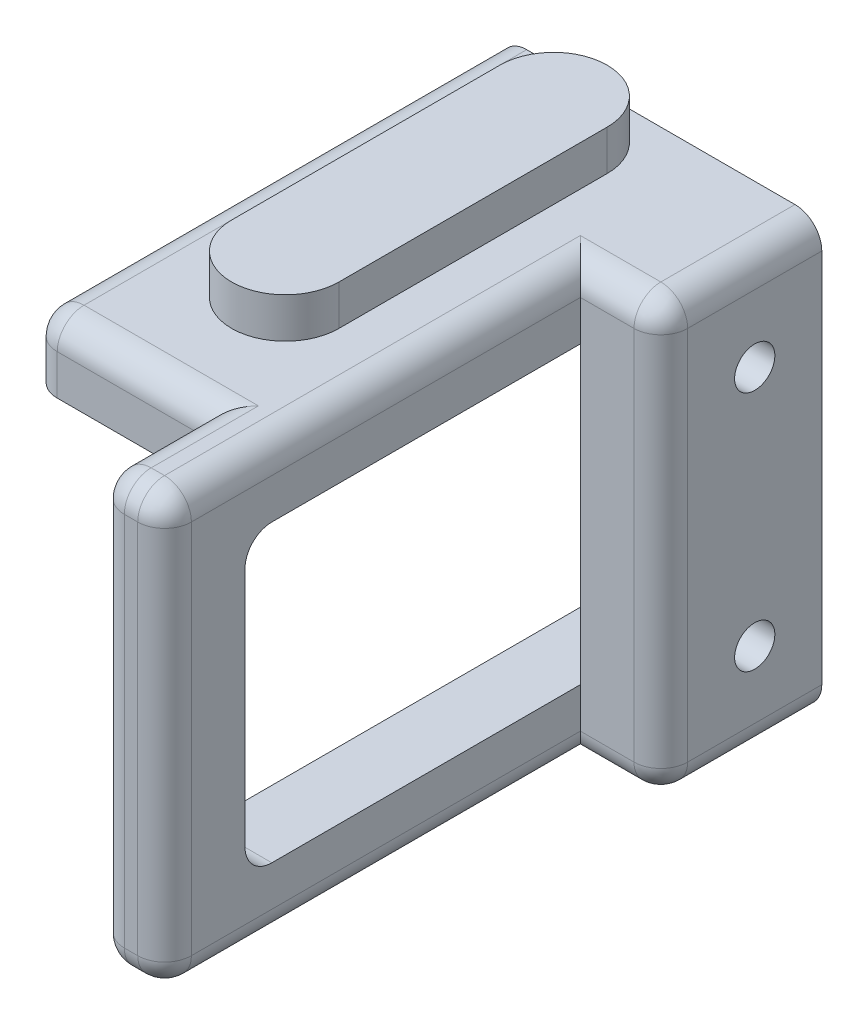
from build123d import *

# Parameters (mm, degrees)
BOSS_EXTRUDE1_DEPTH = 5
SKETCH2_W           = 12
SKETCH2_H           = 32
BOSS_EXTRUDE2_DEPTH = 6
CUT_EXTRUDE1_REACH  = 53.952
AGUJEROSMOTOR_R     = 1.5
FILLET1_R           = 2
SKETCH5_W           = 35
SKETCH5_H           = 5
BOSS_EXTRUDE3_DEPTH = 13
FILLET2_R           = 2
FILLET3_R           = 2
FILLET4_R           = 2
BOSS_EXTRUDE4_DEPTH = 3


with BuildPart() as part:
    # Sketch U → Boss-Extrude1 (new body)
    with BuildSketch(Plane(origin=(0, 0, 0), x_dir=(0, 0, -1), z_dir=(1, 0, 0))):
        with BuildLine():
            Line((0, 22), (0, 27))
            Line((0, 27), (-41, 27))
            ThreePointArc((-41, 27), (-42.414213562, 26.414213562), (-43, 25))
            Line((-43, 25), (-43, -3))
            ThreePointArc((-43, -3), (-42.414213562, -4.414213562), (-41, -5))
            Line((-41, -5), (0, -5))
            Line((0, -5), (0, 0))
            Line((0, 0), (-35, 0))
            ThreePointArc((-35, 0), (-36.414213562, 0.585786438), (-37, 2))
            Line((-37, 2), (-37, 20))
            ThreePointArc((-37, 20), (-36.414213562, 21.414213562), (-35, 22))
            Line((-35, 22), (0, 22))
        make_face()
    extrude(amount=-BOSS_EXTRUDE1_DEPTH)

    # Sketch2 → Boss-Extrude2 (add)
    with BuildSketch(Plane(origin=(0, 0, 0), x_dir=(0, 0, -1), z_dir=(1, 0, 0))):
        with Locations((-6, 11)):
            Rectangle(SKETCH2_W, SKETCH2_H)
    extrude(amount=BOSS_EXTRUDE2_DEPTH)

    # AgujerosMotor → Cut-Extrude1 (cut, up to next)
    with BuildSketch(Plane(origin=(6, 0, 0), x_dir=(0, 0, -1), z_dir=(1, 0, 0)), mode=Mode.PRIVATE) as cut_extrude1_sk1:
        with Locations((-5, 2)):
            Circle(AGUJEROSMOTOR_R)
    cut_extrude1_tool1 = extrude(cut_extrude1_sk1.sketch, amount=-CUT_EXTRUDE1_REACH, mode=Mode.PRIVATE) & part.part
    # AgujerosMotor → Cut-Extrude1 (cut, up to next)
    with BuildSketch(Plane(origin=(6, 0, 0), x_dir=(0, 0, -1), z_dir=(1, 0, 0)), mode=Mode.PRIVATE) as cut_extrude1_sk2:
        with Locations((-5, 20)):
            Circle(AGUJEROSMOTOR_R)
    cut_extrude1_tool2 = extrude(cut_extrude1_sk2.sketch, amount=-CUT_EXTRUDE1_REACH, mode=Mode.PRIVATE) & part.part
    add(cut_extrude1_tool1.solids().sort_by_distance((6, 2, 5))[0], mode=Mode.SUBTRACT)
    add(cut_extrude1_tool2.solids().sort_by_distance((6, 20, 5))[0], mode=Mode.SUBTRACT)

    # Fillet1
    fillet1_edges = [part.edges().sort_by_distance(p)[0] for p in [
        (6, 27, 6),
        (6, -5, 6),
    ]]
    fillet(fillet1_edges, radius=FILLET1_R)

    # Sketch5 → Boss-Extrude3 (add)
    with BuildSketch(Plane.ZY.offset(5)):
        with Locations((17.5, 24.5)):
            Rectangle(SKETCH5_W, SKETCH5_H)
    extrude(amount=BOSS_EXTRUDE3_DEPTH)

    # Fillet2
    fillet2_edges = [part.edges().sort_by_distance(p)[0] for p in [
        (-18, 24.5, 35),
    ]]
    fillet(fillet2_edges, radius=FILLET2_R)

    # Fillet3
    fillet3_edges = [part.edges().sort_by_distance(p)[0] for p in [
        (0, -5, 26.5),
        (0, -4.414213562, 42.414213562),
        (0, 11, 43),
        (0, 26.414213562, 42.414213562),
        (0, 27, 26.5),
        (-5, 26.414213562, 42.414213562),
        (-5, 11, 43),
        (-5, -4.414213562, 42.414213562),
        (-5, -5, 20.5),
        (6, 11, 12),
        (2, -5, 12),
        (2, 27, 12),
        (5.414213562, -4.414213562, 12),
        (5.414213562, 26.414213562, 12),
        (-5, 27, 38),
    ]]
    fillet(fillet3_edges, radius=FILLET3_R)

    # Fillet4
    fillet4_edges = [part.edges().sort_by_distance(p)[0] for p in [
        (-18, 27, 16.5),
        (-17.414213562, 27, 34.414213562),
        (-9.5, 27, 35),
    ]]
    fillet(fillet4_edges, radius=FILLET4_R)

    # Encastre → Boss-Extrude4 (add)
    with BuildSketch(Plane(origin=(0, 27, 0), x_dir=(1, 0, 0), z_dir=(0, 1, 0))):
        with BuildLine():
            Line((-5, -5), (-5, -25))
            ThreePointArc((-5, -25), (-9, -29), (-13, -25))
            Line((-13, -25), (-13, -5))
            ThreePointArc((-13, -5), (-9, -1), (-5, -5))
        make_face()
    extrude(amount=BOSS_EXTRUDE4_DEPTH)


solid = part.part
